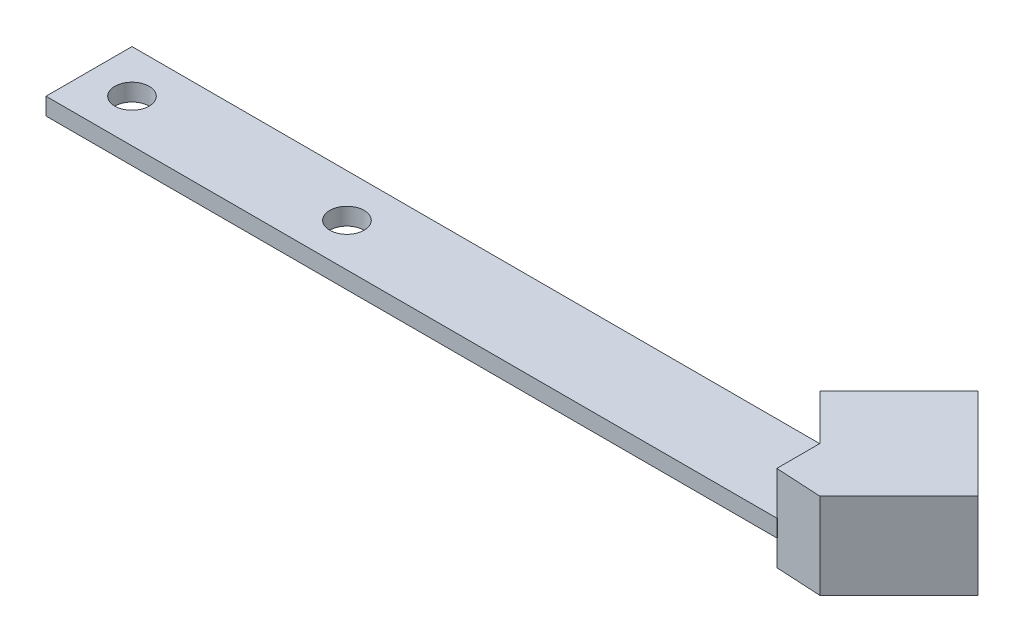
from build123d import *

# Parameters (mm, degrees)
SKETCH1_W           = 85
SKETCH1_H           = 10
SKETCH1_R           = 2
BOSS_EXTRUDE1_DEPTH = 2
CUT_EXTRUDE1_DEPTH  = 10
SKETCH3_W           = 15
SKETCH3_H           = 10
BOSS_EXTRUDE2_DEPTH = 13
BOSS_EXTRUDE3_DEPTH = 10


with BuildPart() as part:
    # Sketch1 → Boss-Extrude1 (new body)
    with BuildSketch(Plane(origin=(0, 0, 0), x_dir=(1, 0, 0), z_dir=(0, 1, 0))):
        with Locations((18.270818553, 2.053936679)):
            Rectangle(SKETCH1_W, SKETCH1_H)
        with Locations(Location((-19.229181447, 2.053936679, 0), (0, 0, 270))):
            Circle(SKETCH1_R, mode=Mode.SUBTRACT)
        with Locations(Location((5.770818553, 2.053936679, 0), (0, 0, 270))):
            Circle(SKETCH1_R, mode=Mode.SUBTRACT)
    extrude(amount=BOSS_EXTRUDE1_DEPTH)

    # Sketch2 → Cut-Extrude1 (cut)
    with BuildSketch(Plane(origin=(0, 2, 0), x_dir=(1, 0, 0), z_dir=(0, 1, 0))):
        Polygon((55.770818553, 7.053936679), (60.770818553, 2.053936679), (60.770818553, 7.053936679), align=None)
    extrude(amount=-CUT_EXTRUDE1_DEPTH, mode=Mode.SUBTRACT)

    # Sketch3 → Boss-Extrude2 (add)
    with BuildSketch(Plane(origin=(31.412377616, 0, -31.412377616), x_dir=(-0.7071067811865488, 0, -0.7071067811865462), z_dir=(0.7071067811865462, 0, -0.7071067811865488))):
        with Locations((-41.420324571, 1.952612945)):
            Rectangle(SKETCH3_W, SKETCH3_H)
    extrude(amount=BOSS_EXTRUDE2_DEPTH)

    # Sketch4 → Boss-Extrude3 (add)
    with BuildSketch(Plane(origin=(0, 6.952612945, 0), x_dir=(1, 0, 0), z_dir=(0, 1, 0))):
        Polygon((60.70097, 2.123785233), (60.70097, -2.890998226), (66.004270859, -3.179515626), align=None)
    extrude(amount=-BOSS_EXTRUDE3_DEPTH)


solid = part.part
